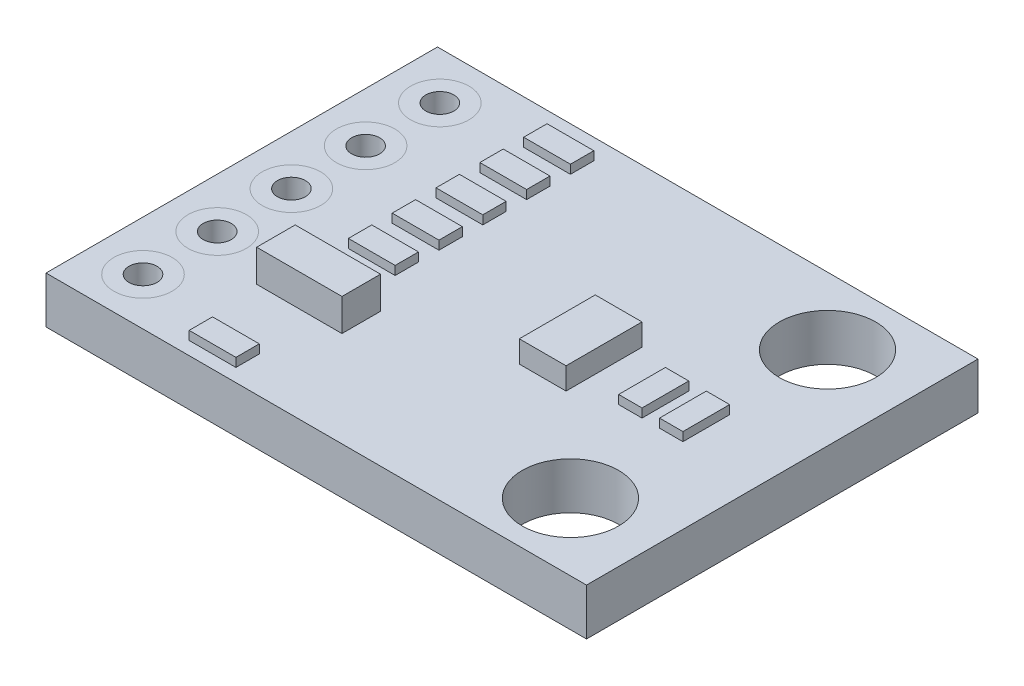
from build123d import *

# Parameters (mm, degrees)
SKETCH2_W               = 18.5
SKETCH2_H               = 13.4
BOSS_EXTRUDE1_DEPTH     = 1.6
CUT_EXTRUDE1_DEPTH      = 12.533104526
CUT_EXTRUDE1_DEPTH_BACK = 12.533104526
SKETCH3_R               = 0.48
SKETCH3_R_2             = 1.65
SKETCH6_W               = 1.6
SKETCH6_H               = 0.8
SKETCH6_W_2             = 0.8
SKETCH6_H_2             = 1.6
BOSS_EXTRUDE2_DEPTH     = 0.3
SKETCH7_W               = 2.92
SKETCH7_H               = 1.32
BOSS_EXTRUDE3_DEPTH     = 1.1
SKETCH8_W               = 1.6
SKETCH8_H               = 2.6
BOSS_EXTRUDE4_DEPTH     = 0.75


with BuildPart() as part:
    # Sketch2 → Boss-Extrude1 (new body)
    with BuildSketch(Plane(origin=(0, 0, 0), x_dir=(1, 0, 0), z_dir=(0, 1, 0))):
        Rectangle(SKETCH2_W, SKETCH2_H)
    extrude(amount=BOSS_EXTRUDE1_DEPTH)

    # Sketch3 → Cut-Extrude1 (cut, two sides: drawn at the far end of the back side and taken through both)
    with BuildSketch(Plane(origin=(0, 1.6, 0), x_dir=(1, 0, 0), z_dir=(0, 1, 0)).offset(-CUT_EXTRUDE1_DEPTH_BACK)):
        with Locations(Location((-7.55, 5.08, 0), (0, 0, 270))):
            Circle(SKETCH3_R)
        with Locations(Location((-7.55, 2.54, 0), (0, 0, 270))):
            Circle(SKETCH3_R)
        with Locations(Location((-7.55, 0, 0), (0, 0, 270))):
            Circle(SKETCH3_R)
        with Locations(Location((-7.55, -2.54, 0), (0, 0, 270))):
            Circle(SKETCH3_R)
        with Locations(Location((-7.55, -5.08, 0), (0, 0, 270))):
            Circle(SKETCH3_R)
        with Locations(Location((6.4, 4.4, 0), (0, 0, 270))):
            Circle(SKETCH3_R_2)
        with Locations(Location((6.4, -4.4, 0), (0, 0, 270))):
            Circle(SKETCH3_R_2)
    extrude(amount=CUT_EXTRUDE1_DEPTH + CUT_EXTRUDE1_DEPTH_BACK, mode=Mode.SUBTRACT)

    # Sketch6 → Boss-Extrude2 (add)
    with BuildSketch(Plane(origin=(0, 1.6, 0), x_dir=(1, 0, 0), z_dir=(0, 1, 0))):
        with Locations((-4, 5.6)):
            Rectangle(SKETCH6_W, SKETCH6_H)
        with Locations((-4, 4.1)):
            Rectangle(SKETCH6_W, SKETCH6_H)
        with Locations((-4, 2.6)):
            Rectangle(SKETCH6_W, SKETCH6_H)
        with Locations((-4, 1.1)):
            Rectangle(SKETCH6_W, SKETCH6_H)
        with Locations((-4, -0.4)):
            Rectangle(SKETCH6_W, SKETCH6_H)
        with Locations((-4, -5.85)):
            Rectangle(SKETCH6_W, SKETCH6_H)
        with Locations((6.25, 0)):
            Rectangle(SKETCH6_W_2, SKETCH6_H_2)
        with Locations((4.85, 0)):
            Rectangle(SKETCH6_W_2, SKETCH6_H_2)
    extrude(amount=BOSS_EXTRUDE2_DEPTH)

    # Sketch7 → Boss-Extrude3 (add)
    with BuildSketch(Plane(origin=(0, 1.6, 0), x_dir=(1, 0, 0), z_dir=(0, 1, 0))):
        with Locations((-3.85, -2.77)):
            Rectangle(SKETCH7_W, SKETCH7_H)
    extrude(amount=BOSS_EXTRUDE3_DEPTH)

    # Sketch8 → Boss-Extrude4 (add)
    with BuildSketch(Plane(origin=(0, 1.6, 0), x_dir=(1, 0, 0), z_dir=(0, 1, 0))):
        with Locations((2.35, 0)):
            Rectangle(SKETCH8_W, SKETCH8_H)
    extrude(amount=BOSS_EXTRUDE4_DEPTH)


solid = part.part
